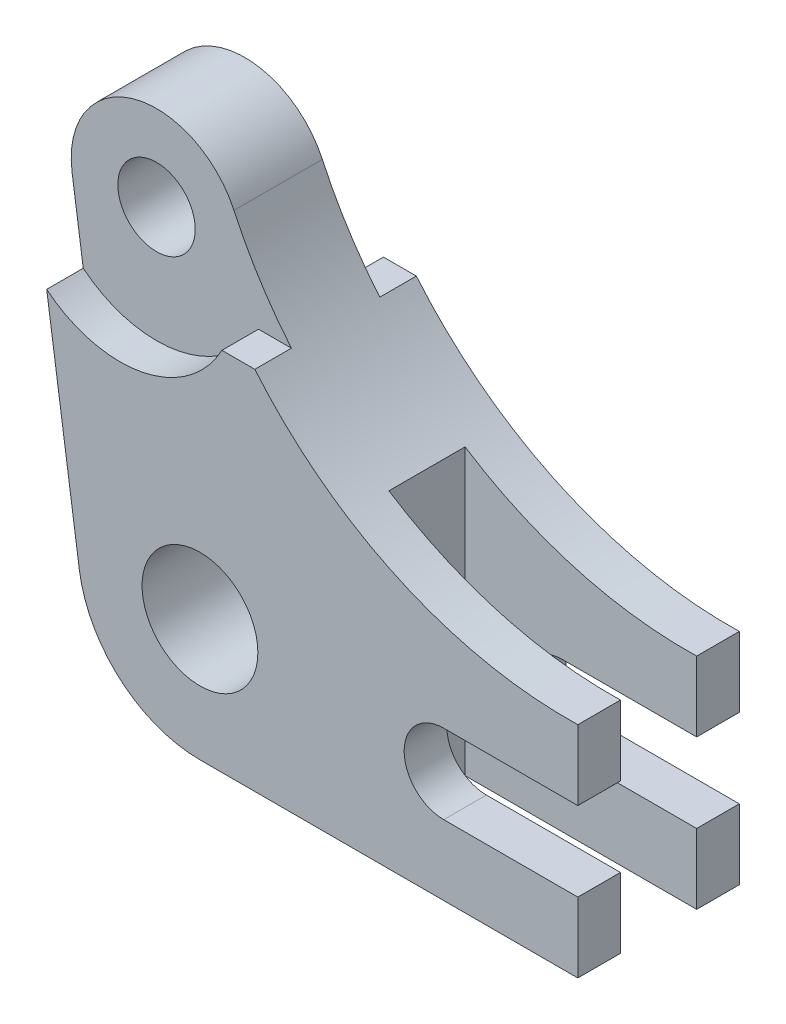
from build123d import *

# Parameters (mm, degrees)
SKETCH3_R               = 14
SKETCH3_R_2             = 6.35
SKETCH3_R_3             = 20
SKETCH3_R_4             = 9.5
BOSS_EXTRUDE6_DEPTH     = 26.5
CUT_EXTRUDE5_START      = 7
SKETCH7_W               = 38
SKETCH7_H               = 71.155333985
CUT_EXTRUDE5_DEPTH      = 12.5
CUT_EXTRUDE6_DEPTH      = 93.278112248
CUT_EXTRUDE6_DEPTH_BACK = 6
CUT_EXTRUDE8_DEPTH      = 93.278112248
CUT_EXTRUDE8_DEPTH_BACK = 6


with BuildPart() as part:
    # Sketch3 → Boss-Extrude6 (new body)
    # profile 1 of 3: a face of its own
    with BuildSketch(Plane.XY):
        with BuildLine():
            ThreePointArc((0.870489571, 49), (-12.127650844, 35.035893248), (-26.986121482, 47.001417973))
            Line((-26.986121482, 47.001417973), (-19.795158647, -2.855117182))
            ThreePointArc((-19.795158647, -2.855117182), (-1.431227978, 19.948723931), (20, 0))
            ThreePointArc((20, 0), (14.142135624, -14.142135624), (0, -20))
            Line((0, -20), (62, -20))
            Line((62, -20), (62, -8.5))
            Line((62, -8.5), (40, -8.5))
            ThreePointArc((40, -8.5), (33.5, -2), (40, 4.5))
            Line((40, 4.5), (62, 4.5))
            Line((62, 4.5), (62, 16))
            ThreePointArc((62, 16), (24.979840385, 26.107737846), (-0.421043253, 54.873232673))
            ThreePointArc((-0.421043253, 54.873232673), (0.543794593, 52.006780632), (0.870489571, 49))
        make_face()
    # profile 2 of 3: a face of its own
    with BuildSketch(Plane.XY):
        with Locations((-13.129510429, 49)):
            Circle(SKETCH3_R)
        with Locations((-13.129510429, 49)):
            Circle(SKETCH3_R_2, mode=Mode.SUBTRACT)
    # profile 3 of 3: a face of its own
    with BuildSketch(Plane.XY):
        Circle(SKETCH3_R_3)
        Circle(SKETCH3_R_4, mode=Mode.SUBTRACT)
    extrude(amount=BOSS_EXTRUDE6_DEPTH)

    # Sketch7 → Cut-Extrude5 (cut)
    with BuildSketch(Plane.XY.offset(CUT_EXTRUDE5_START)):
        with Locations((43, 15.577666993)):
            Rectangle(SKETCH7_W, SKETCH7_H)
    extrude(amount=CUT_EXTRUDE5_DEPTH, mode=Mode.SUBTRACT)

    # Sketch8 → Cut-Extrude6 (cut, two sides: drawn at the far end of the back side and taken through both)
    with BuildSketch(Plane.XY.offset(26.5).offset(-CUT_EXTRUDE6_DEPTH_BACK)):
        with BuildLine():
            Line((-191.908254211, 170.560932392), (-25.15238927, 34.287747135))
            ThreePointArc((-25.15238927, 34.287747135), (-9.427586496, 30.364127088), (3.603690102, 40))
            Line((3.603690102, 40), (9.001095845, 40))
            Line((9.001095845, 40), (224.356382551, 40))
            Line((224.356382551, 40), (353.256649812, 450.969973536))
            Line((353.256649812, 450.969973536), (-63.007986949, 581.530905928))
            Line((-63.007986949, 581.530905928), (-191.908254211, 170.560932392))
        make_face()
    extrude(amount=CUT_EXTRUDE6_DEPTH + CUT_EXTRUDE6_DEPTH_BACK, mode=Mode.SUBTRACT)

    # Sketch9 → Cut-Extrude8 (cut, two sides: drawn at the far end of the back side and taken through both)
    with BuildSketch(Plane(origin=(0, 0, 0), x_dir=(-1, 0, 0), z_dir=(0, 0, -1)).offset(-CUT_EXTRUDE8_DEPTH_BACK)):
        with BuildLine():
            Line((191.908254211, 170.560932392), (25.15238927, 34.287747135))
            ThreePointArc((25.15238927, 34.287747135), (9.427586496, 30.364127088), (-3.603690102, 40))
            Line((-3.603690102, 40), (-9.001095845, 40))
            Line((-9.001095845, 40), (-224.356382551, 40))
            Line((-224.356382551, 40), (-353.256649812, 450.969973536))
            Line((-353.256649812, 450.969973536), (63.007986949, 581.530905928))
            Line((63.007986949, 581.530905928), (191.908254211, 170.560932392))
        make_face()
    extrude(amount=CUT_EXTRUDE8_DEPTH + CUT_EXTRUDE8_DEPTH_BACK, mode=Mode.SUBTRACT)


solid = part.part
